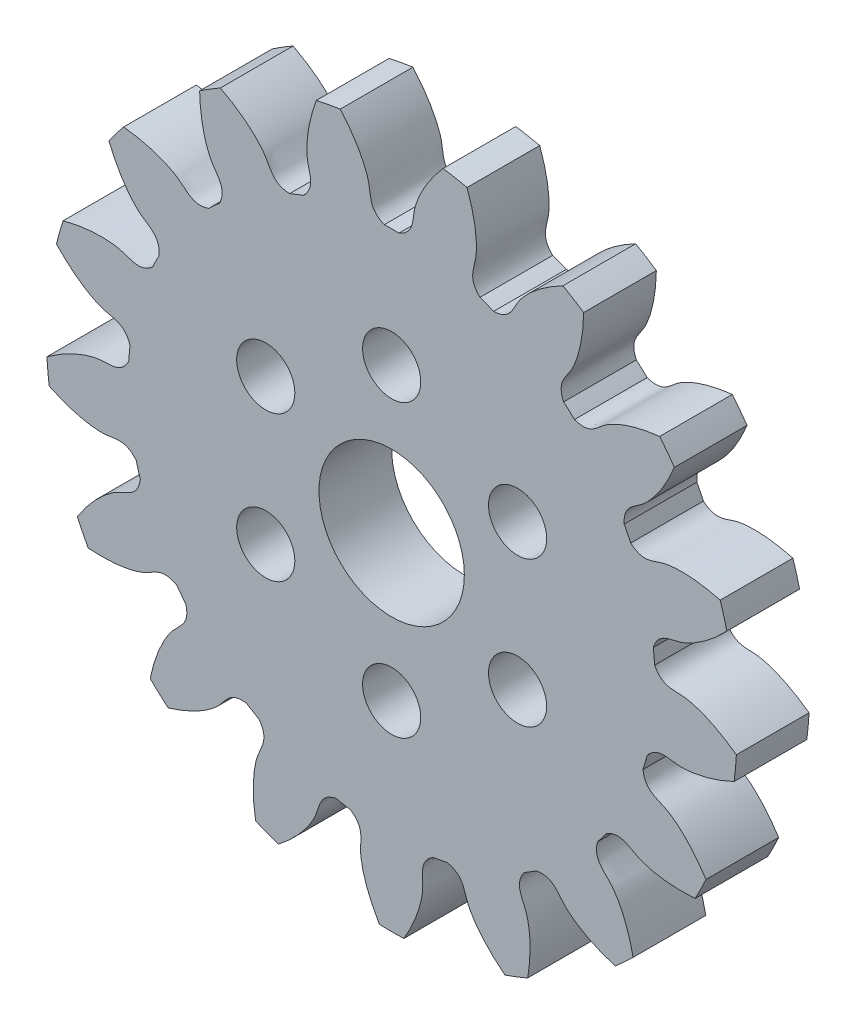
from build123d import *

# Parameters (mm, degrees)
SKETCH_1_R               = 19
EXTRUDE_1_DEPTH          = 4
CUT_EXTRUDE_1_DEPTH      = 28.166155414
PATTERN_CIRCULAR_1_COUNT = 17
SKETCH_4_R               = 4
SKETCH_4_R_2             = 1.6
CUT_EXTRUDE_2_DEPTH      = 10


with BuildPart() as part:
    # 草图1 → 凸台-拉伸1 (new body)
    with BuildSketch(Plane.XY):
        Circle(SKETCH_1_R)
    extrude(amount=EXTRUDE_1_DEPTH)

    # 草图2 → 切除-拉伸1 (cut, through all)
    with BuildSketch(Plane.XY):
        with BuildLine():
            ThreePointArc((0.403387494, 14.494387829), (0, 14.5), (-0.403387494, 14.494387829))
            add(Edge.make_bspline(
                [(-0.403387494, 14.494387829), (-1.255759481, 14.849644042), (-1.132390756, 15.509626813), (-1.276611209, 16.129648275), (-1.289951469, 16.18230119), (-1.306037005, 16.240838627), (-1.32510118, 16.305170665), (-1.347383555, 16.375198727), (-1.373118159, 16.450817515), (-1.40253689, 16.531914502), (-1.435868224, 16.618370188), (-1.473337358, 16.710058129), (-1.515165928, 16.80684504), (-1.561571855, 16.908590882), (-1.612769151, 17.015148962), (-1.66896775, 17.12636603), (-1.730373323, 17.242082389), (-1.797187111, 17.362132), (-1.869605751, 17.4863426), (-1.947821109, 17.61453582), (-2.032020115, 17.746527309), (-2.1223846, 17.882126855), (-2.219091138, 18.021138524), (-2.32231089, 18.163360791), (-2.432209452, 18.308586678), (-2.548946705, 18.456603899), (-2.67267667, 18.607195006), (-2.803547366, 18.760137539), (-2.941700674, 18.915204179), (-3.087272199, 19.072162909), (-3.24039114, 19.23077717), (-3.401180166, 19.390806026), (-3.569755292, 19.552004336), (-3.746225758, 19.71412292), (-3.930693918, 19.876908731), (-4.123255131, 20.040105038), (-4.323997649, 20.203451599), (-4.533002522, 20.366684847), (-4.750343497, 20.529538073), (-4.976086928, 20.691741613), (-5.210291694, 20.853023038), (-5.453009069, 21.013107349), (-5.79164327, 21.226861067), (-6.053153804, 21.381051942), (-6.231291666, 21.481438237)],
                knots=[0, 0, 0, 0, 0.193882922, 0.199023975, 0.204850501, 0.211362501, 0.218559975, 0.226442923, 0.235011345, 0.24426524, 0.254204608, 0.264829451, 0.276139767, 0.288135557, 0.300816821, 0.314183558, 0.328235769, 0.342973453, 0.358396612, 0.374505244, 0.39129935, 0.408778929, 0.426943982, 0.445794509, 0.46533051, 0.485551984, 0.506458932, 0.528051354, 0.550329249, 0.573292619, 0.596941461, 0.621275778, 0.646295568, 0.672000832, 0.69839157, 0.725467781, 0.753229466, 0.781676625, 0.810809257, 0.840627364, 0.871130943, 0.902319997, 0.934194524, 1, 1, 1, 1], degree=3))
            ThreePointArc((-6.231291666, 21.481438237), (0, 22.366966369), (6.231291666, 21.481438237))
            add(Edge.make_bspline(
                [(0.403387494, 14.494387829), (1.255759481, 14.849644042), (1.132390756, 15.509626813), (1.276611209, 16.129648275), (1.289951469, 16.18230119), (1.306037005, 16.240838627), (1.32510118, 16.305170665), (1.347383555, 16.375198727), (1.373118159, 16.450817515), (1.40253689, 16.531914502), (1.435868224, 16.618370188), (1.473337358, 16.710058129), (1.515165928, 16.80684504), (1.561571855, 16.908590882), (1.612769151, 17.015148962), (1.66896775, 17.12636603), (1.730373323, 17.242082389), (1.797187111, 17.362132), (1.869605751, 17.4863426), (1.947821109, 17.61453582), (2.032020115, 17.746527309), (2.1223846, 17.882126855), (2.219091138, 18.021138524), (2.32231089, 18.163360791), (2.432209452, 18.308586678), (2.548946705, 18.456603899), (2.67267667, 18.607195006), (2.803547366, 18.760137539), (2.941700674, 18.915204179), (3.087272199, 19.072162909), (3.24039114, 19.23077717), (3.401180166, 19.390806026), (3.569755292, 19.552004336), (3.746225758, 19.71412292), (3.930693918, 19.876908731), (4.123255131, 20.040105038), (4.323997649, 20.203451599), (4.533002522, 20.366684847), (4.750343497, 20.529538073), (4.976086928, 20.691741613), (5.210291694, 20.853023038), (5.453009069, 21.013107349), (5.79164327, 21.226861067), (6.053153804, 21.381051942), (6.231291666, 21.481438237)],
                knots=[0, 0, 0, 0, 0.193882922, 0.199023975, 0.204850501, 0.211362501, 0.218559975, 0.226442923, 0.235011345, 0.24426524, 0.254204608, 0.264829451, 0.276139767, 0.288135557, 0.300816821, 0.314183558, 0.328235769, 0.342973453, 0.358396612, 0.374505244, 0.39129935, 0.408778929, 0.426943982, 0.445794509, 0.46533051, 0.485551984, 0.506458932, 0.528051354, 0.550329249, 0.573292619, 0.596941461, 0.621275778, 0.646295568, 0.672000832, 0.69839157, 0.725467781, 0.753229466, 0.781676625, 0.810809257, 0.840627364, 0.871130943, 0.902319997, 0.934194524, 1, 1, 1, 1], degree=3))
        make_face()
    cut_extrude_1 = extrude(amount=CUT_EXTRUDE_1_DEPTH, mode=Mode.SUBTRACT)

    # 阵列(圆周)1: 切除-拉伸1 ×17 about axis
    pattern_circular_1_axis = Axis((0, 0, 4), (0, 0, -1))
    for i in range(1, PATTERN_CIRCULAR_1_COUNT):
        add(cut_extrude_1.rotate(pattern_circular_1_axis, i * 360 / PATTERN_CIRCULAR_1_COUNT), mode=Mode.SUBTRACT)

    # 草图4 → 切除-拉伸2 (cut)
    with BuildSketch(Plane.XY.offset(4)):
        Circle(SKETCH_4_R)
        with Locations((0, 8)):
            Circle(SKETCH_4_R_2)
        with Locations((6.92820323, 4)):
            Circle(SKETCH_4_R_2)
        with Locations((6.92820323, -4)):
            Circle(SKETCH_4_R_2)
        with Locations((0, -8)):
            Circle(SKETCH_4_R_2)
        with Locations((-6.92820323, -4)):
            Circle(SKETCH_4_R_2)
        with Locations((-6.92820323, 4)):
            Circle(SKETCH_4_R_2)
    extrude(amount=-CUT_EXTRUDE_2_DEPTH, mode=Mode.SUBTRACT)


solid = part.part
